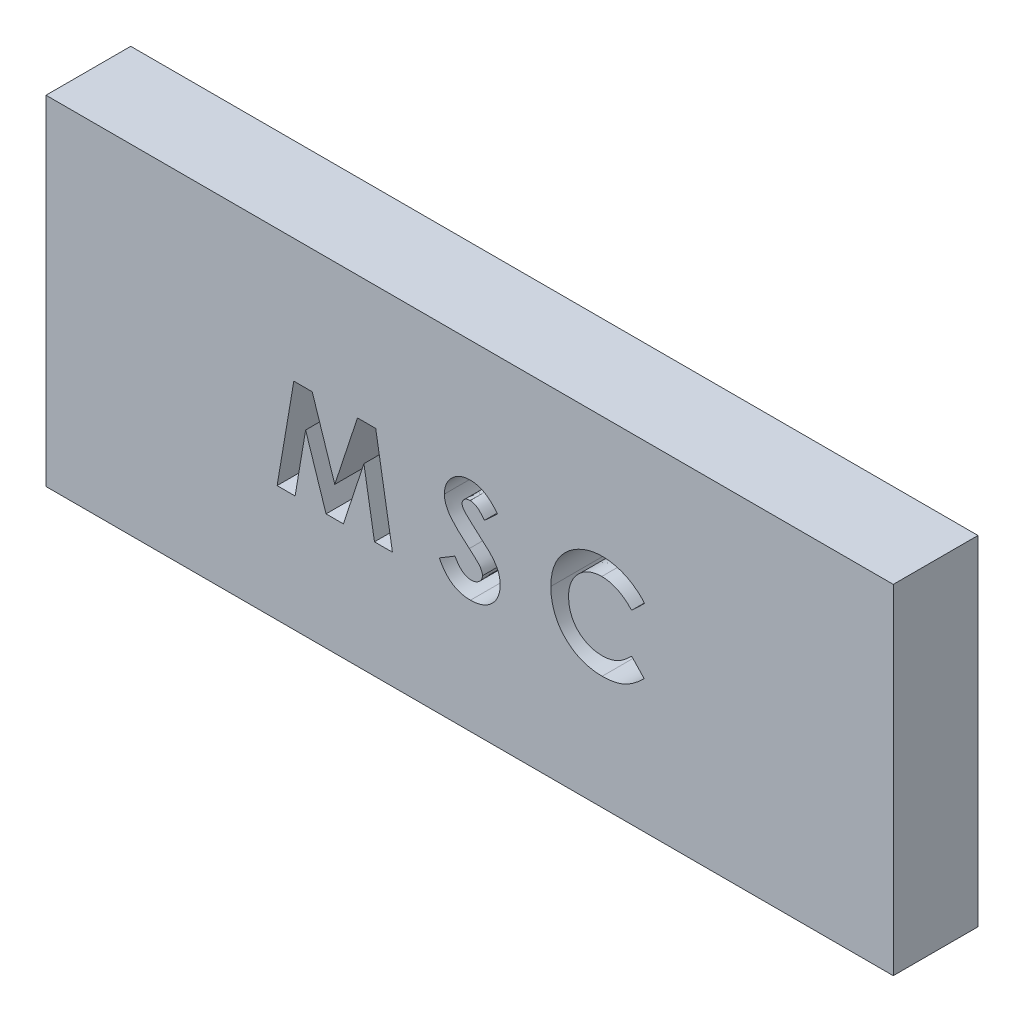
from build123d import *

# Parameters (mm, degrees)
ESQUISSE1_W        = 30
ESQUISSE1_H        = 12
BOSS_EXTRU_1_DEPTH = 3


with BuildPart() as part:
    # Esquisse1 → Boss.-Extru.1 (new body)
    with BuildSketch(Plane.XY):
        Rectangle(ESQUISSE1_W, ESQUISSE1_H)
        Polygon((-6.225764597, 1.619632403), (-5.573721328, 1.619632403), (-4.775143604, -0.821673687), (-3.970956905, 1.619632403), (-3.325223732, 1.619632403), (-2.733476937, -1.880367597), (-3.369394405, -1.880367597), (-3.743092322, 0.330269422), (-4.470856745, -1.880367597), (-5.083637193, -1.880367597), (-5.807194886, 0.330269422), (-6.180191681, -1.880367597), (-6.81681027, -1.880367597), align=None, mode=Mode.SUBTRACT)
        with BuildLine():
            Line((0.990882037, 1.151984166), (0.521130435, 0.722196505))
            add(Edge.make_bspline(
                [(0.521130435, 0.722196505), (0.50100829, 0.750580882), (0.462376579, 0.805074927), (0.399758605, 0.878043737), (0.337423383, 0.940291562), (0.274793415, 0.99155836), (0.211313573, 1.031532647), (0.14709405, 1.059834883), (0.082498922, 1.077826884), (0.039100968, 1.080067321), (0.017724986, 1.081170864)],
                knots=[0, 0, 0, 0, 1.299362458, 2.494594718, 3.587462134, 4.587049575, 5.512617175, 6.380583204, 7.202344345, 8, 8, 8, 8], degree=3))
            add(Edge.make_bspline(
                [(0.017724986, 1.081170864), (-0.002213917, 1.080471608), (-0.040710699, 1.079121529), (-0.095590718, 1.06570184), (-0.144313981, 1.042541428), (-0.186832935, 1.01225724), (-0.22051422, 0.975771815), (-0.247406114, 0.937507986), (-0.26254851, 0.895273371), (-0.264541547, 0.866264934), (-0.265528219, 0.851904037)],
                knots=[0, 0, 0, 0, 1.185010067, 2.2879431, 3.333075148, 4.379039566, 5.372662701, 6.27520591, 7.14612461, 8, 8, 8, 8], degree=3))
            add(Edge.make_bspline(
                [(-0.265528219, 0.851904037), (-0.264909922, 0.83733605), (-0.263664758, 0.807998147), (-0.251638164, 0.764999798), (-0.233510653, 0.722985405), (-0.216189076, 0.697409244), (-0.20733511, 0.684335928)],
                knots=[0, 0, 0, 0, 0.967525499, 1.948461899, 2.951351359, 4, 4, 4, 4], degree=3))
            add(Edge.make_bspline(
                [(-0.20733511, 0.684335928), (-0.199285898, 0.674174177), (-0.180757673, 0.650783166), (-0.145428144, 0.613735452), (-0.101061675, 0.56834876), (-0.045950952, 0.516183804), (0.017616229, 0.455364529), (0.092586288, 0.388281764), (0.176801259, 0.312858034), (0.23665931, 0.260335679), (0.268025467, 0.232813493)],
                knots=[0, 0, 0, 0, 0.473873513, 1.090794244, 1.870441696, 2.795289791, 3.865433203, 5.087734844, 6.473946851, 8, 8, 8, 8], degree=3))
            add(Edge.make_bspline(
                [(0.268025467, 0.232813493), (0.297467117, 0.207333229), (0.353341253, 0.158976983), (0.432839053, 0.090343055), (0.502704379, 0.028594784), (0.563955009, -0.025341121), (0.615662443, -0.072030571), (0.658044061, -0.111696742), (0.691617481, -0.143567406), (0.710702004, -0.162817306), (0.718846781, -0.171032661)],
                knots=[0, 0, 0, 0, 1.543621617, 2.929473131, 4.163658386, 5.240097082, 6.164993805, 6.925417477, 7.541396219, 8, 8, 8, 8], degree=3))
            add(Edge.make_bspline(
                [(0.718846781, -0.171032661), (0.749746365, -0.204472629), (0.809146218, -0.268755992), (0.886345087, -0.368374987), (0.949882253, -0.465623438), (0.99903581, -0.562331234), (1.036158553, -0.659893676), (1.062330578, -0.760703476), (1.078005179, -0.865814034), (1.079745425, -0.937539158), (1.080625627, -0.973817116)],
                knots=[0, 0, 0, 0, 1.206664779, 2.319633467, 3.337109185, 4.282041471, 5.190008762, 6.099243693, 7.03861361, 8, 8, 8, 8], degree=3))
            add(Edge.make_bspline(
                [(1.080625627, -0.973817116), (1.079999122, -1.009165538), (1.078769895, -1.078520456), (1.063714228, -1.180011049), (1.042245729, -1.27714195), (1.009051664, -1.36885624), (0.968594935, -1.456659379), (0.917876581, -1.539183674), (0.858314829, -1.617264305), (0.790047917, -1.689505485), (0.714536605, -1.755059349), (0.633543546, -1.813416947), (0.54627675, -1.861598577), (0.45348181, -1.901272713), (0.355208398, -1.931830263), (0.251573586, -1.954415141), (0.142418858, -1.967970228), (0.067777283, -1.969387252), (0.029644057, -1.970111187)],
                knots=[0, 0, 0, 0, 1.043214005, 2.046824704, 3.02475056, 3.976699089, 4.921714032, 5.875962561, 6.831408892, 7.817874052, 8.806269674, 9.781291748, 10.760897367, 11.74438705, 12.757449933, 13.795994037, 14.874007457, 16, 16, 16, 16], degree=3))
            add(Edge.make_bspline(
                [(0.029644057, -1.970111187), (-0.000290201, -1.969580133), (-0.059577199, -1.968528342), (-0.14695727, -1.959941346), (-0.231332607, -1.946082847), (-0.312608168, -1.926219478), (-0.391150114, -1.901049895), (-0.46696167, -1.870306214), (-0.539519484, -1.833511919), (-0.609372562, -1.791423647), (-0.676181334, -1.74255362), (-0.740790569, -1.687900968), (-0.802558507, -1.62662511), (-0.861781807, -1.558870961), (-0.918081542, -1.484446657), (-0.973300604, -1.404388695), (-1.024984891, -1.317211307), (-1.056912575, -1.256055664), (-1.073220527, -1.224818719)],
                knots=[0, 0, 0, 0, 1.016823716, 2.013894106, 2.979844003, 3.91962641, 4.853723003, 5.779685073, 6.695824784, 7.614987388, 8.547259901, 9.504950863, 10.487499108, 11.500346958, 12.559593716, 13.656357062, 14.802919212, 16, 16, 16, 16], degree=3))
            Line((-1.073220527, -1.224818719), (-0.520736552, -0.89318811))
            add(Edge.make_bspline(
                [(-0.520736552, -0.89318811), (-0.500337742, -0.928646124), (-0.461231478, -0.996622167), (-0.394962259, -1.087956596), (-0.327072827, -1.166169416), (-0.25599364, -1.22987821), (-0.182588993, -1.279934846), (-0.106504325, -1.315708792), (-0.027686182, -1.337852823), (0.026001157, -1.340557121), (0.052781076, -1.341906059)],
                knots=[0, 0, 0, 0, 1.283663364, 2.460892379, 3.537111102, 4.529833553, 5.449777664, 6.316464042, 7.160231139, 8, 8, 8, 8], degree=3))
            add(Edge.make_bspline(
                [(0.052781076, -1.341906059), (0.080020087, -1.340804443), (0.132867735, -1.338667148), (0.20830099, -1.318925601), (0.277461055, -1.287929924), (0.337242504, -1.243703367), (0.387861666, -1.192659198), (0.425221513, -1.135870226), (0.448691221, -1.074425929), (0.451172538, -1.031742679), (0.452420499, -1.01027545)],
                knots=[0, 0, 0, 0, 1.13588714, 2.203786484, 3.234766741, 4.283437687, 5.291419208, 6.222934724, 7.106237994, 8, 8, 8, 8], degree=3))
            add(Edge.make_bspline(
                [(0.452420499, -1.01027545), (0.451268059, -0.990303686), (0.448926986, -0.949732961), (0.431683371, -0.889410817), (0.404726339, -0.829116106), (0.372834271, -0.779660752), (0.340380097, -0.738253125), (0.309346588, -0.70237529), (0.271555982, -0.662736563), (0.227104101, -0.619287081), (0.17657827, -0.571644349), (0.119935927, -0.519813031), (0.056528458, -0.464249699), (0.011711934, -0.426400507), (-0.011722129, -0.406609584)],
                knots=[0, 0, 0, 0, 0.916159276, 1.861089862, 2.860218735, 3.940849679, 4.552606315, 5.27541173, 6.11797699, 7.06649574, 8.129236253, 9.306560635, 10.591630461, 12, 12, 12, 12], degree=3))
            add(Edge.make_bspline(
                [(-0.011722129, -0.406609584), (-0.056271216, -0.368916785), (-0.141774397, -0.296572895), (-0.262601239, -0.189723247), (-0.371477043, -0.08986246), (-0.467461439, 0.004243963), (-0.551777419, 0.090858094), (-0.623853956, 0.170683448), (-0.682899258, 0.244335766), (-0.745031707, 0.331572009), (-0.804069956, 0.437875365), (-0.855095756, 0.565770625), (-0.888199142, 0.693649658), (-0.891907916, 0.779500597), (-0.893733347, 0.8217558)],
                knots=[0, 0, 0, 0, 1.345494975, 2.582412109, 3.71882943, 4.751509156, 5.681369928, 6.505683931, 7.230279997, 7.856715994, 8.973648664, 10.023341002, 11.027102913, 12, 12, 12, 12], degree=3))
            add(Edge.make_bspline(
                [(-0.893733347, 0.8217558), (-0.892974153, 0.851720923), (-0.891478458, 0.910755433), (-0.878136631, 0.997557078), (-0.858196762, 1.081313372), (-0.829238347, 1.161718734), (-0.791653821, 1.238672453), (-0.746008875, 1.312551251), (-0.691594728, 1.382675162), (-0.630273658, 1.4489977), (-0.562713538, 1.509608952), (-0.490516965, 1.563104455), (-0.414092577, 1.608287535), (-0.3339079, 1.645770181), (-0.249466063, 1.674460765), (-0.161389144, 1.694798081), (-0.069550815, 1.706894068), (-0.007084365, 1.708538377), (0.024736204, 1.709375993)],
                knots=[0, 0, 0, 0, 1.010766082, 1.991317756, 2.957454644, 3.913069143, 4.869106762, 5.843196583, 6.838735724, 7.860187025, 8.887984031, 9.89767229, 10.887916223, 11.879572884, 12.879850636, 13.892031539, 14.926195476, 16, 16, 16, 16], degree=3))
            add(Edge.make_bspline(
                [(0.024736204, 1.709375993), (0.065974087, 1.707867423), (0.148124334, 1.704862192), (0.269585845, 1.681362267), (0.388224371, 1.644406159), (0.483825518, 1.599822681), (0.559893566, 1.556634645), (0.61819262, 1.516872542), (0.677515044, 1.471322915), (0.738339239, 1.419842227), (0.799534996, 1.361460512), (0.862842404, 1.297567595), (0.927398821, 1.22761129), (0.969350256, 1.17763483), (0.990882037, 1.151984166)],
                knots=[0, 0, 0, 0, 1.282922637, 2.555718331, 3.837320111, 5.142675274, 5.830281639, 6.55870424, 7.337177975, 8.157850921, 9.037902056, 9.96903443, 10.957596896, 12, 12, 12, 12], degree=3))
        make_face(mode=Mode.SUBTRACT)
        with BuildLine():
            Line((6.196010242, 1.012460928), (5.735373223, 0.572156441))
            add(Edge.make_bspline(
                [(5.735373223, 0.572156441), (5.696298238, 0.612560041), (5.619972552, 0.691480929), (5.496983147, 0.79596523), (5.369078644, 0.883038758), (5.238747169, 0.956371528), (5.103644438, 1.011852995), (4.965332606, 1.052283275), (4.822928511, 1.076932089), (4.726554896, 1.079752349), (4.678081557, 1.081170864)],
                knots=[0, 0, 0, 0, 1.115251505, 2.178435587, 3.19620269, 4.182487026, 5.141301733, 6.088180966, 7.038406374, 8, 8, 8, 8], degree=3))
            add(Edge.make_bspline(
                [(4.678081557, 1.081170864), (4.637600427, 1.080050188), (4.557715379, 1.077838656), (4.440423194, 1.061625946), (4.328227157, 1.034055526), (4.220743204, 0.996058382), (4.11828761, 0.946892093), (4.020645565, 0.886594714), (3.928057802, 0.815710816), (3.84174735, 0.734607155), (3.762793581, 0.64599531), (3.6930329, 0.551446684), (3.634597139, 0.45117788), (3.586639861, 0.346204349), (3.549282994, 0.236040221), (3.522605499, 0.120759662), (3.507175948, 0.000225383), (3.504872984, -0.081712922), (3.50370255, -0.123356379)],
                knots=[0, 0, 0, 0, 1.035432265, 2.043311493, 3.022114605, 3.98653278, 4.95457646, 5.923598177, 6.917315552, 7.932509744, 8.948865224, 9.949768934, 10.933144597, 11.912367597, 12.897413939, 13.903909035, 14.934704909, 16, 16, 16, 16], degree=3))
            add(Edge.make_bspline(
                [(3.50370255, -0.123356379), (3.504039856, -0.152584671), (3.504704692, -0.210194235), (3.511982504, -0.295414769), (3.523701496, -0.378098834), (3.540661781, -0.458121185), (3.561870785, -0.535551172), (3.586753775, -0.611056778), (3.617969121, -0.683594685), (3.652618625, -0.754007376), (3.6929156, -0.82037355), (3.736363172, -0.883659206), (3.78347497, -0.943554122), (3.834556141, -0.999813447), (3.890325588, -1.051557973), (3.949341877, -1.10034372), (4.012600531, -1.144949415), (4.078787509, -1.186494488), (4.148474581, -1.222585046), (4.219770975, -1.255276119), (4.29375769, -1.28182613), (4.369533892, -1.303227862), (4.446828784, -1.321426838), (4.526398381, -1.332632507), (4.607552915, -1.341118429), (4.662399758, -1.341642386), (4.690000627, -1.341906059)],
                knots=[0, 0, 0, 0, 1.103660481, 2.175337485, 3.227646561, 4.255952547, 5.262355991, 6.258840057, 7.255597736, 8.242457506, 9.22035537, 10.185017736, 11.140346927, 12.096287581, 13.051739095, 14.01125915, 14.986044842, 15.97314143, 16.960198552, 17.947847494, 18.933482797, 19.925264591, 20.920966487, 21.929612487, 22.958107872, 24, 24, 24, 24], degree=3))
            add(Edge.make_bspline(
                [(4.690000627, -1.341906059), (4.736816444, -1.340551897), (4.82879735, -1.337891321), (4.963792556, -1.317085994), (5.092429538, -1.282862408), (5.195209871, -1.242446342), (5.275735548, -1.202534953), (5.337038555, -1.165618882), (5.400430642, -1.124324205), (5.464858921, -1.077092414), (5.531048082, -1.02449031), (5.597829734, -0.965365809), (5.666913499, -0.901665796), (5.712169588, -0.856201845), (5.735373223, -0.832891636)],
                knots=[0, 0, 0, 0, 1.404581149, 2.759636711, 4.088442092, 5.392261763, 6.066678138, 6.783632037, 7.538459478, 8.336747902, 9.180226004, 10.074962426, 11.012997595, 12, 12, 12, 12], degree=3))
            Line((5.735373223, -0.832891636), (6.181987807, -1.301942116))
            add(Edge.make_bspline(
                [(6.181987807, -1.301942116), (6.150593205, -1.332252618), (6.089317658, -1.391412236), (5.996885195, -1.475413373), (5.904569062, -1.550897732), (5.814599425, -1.620605065), (5.725502486, -1.682504629), (5.637287695, -1.736658242), (5.550953681, -1.784435529), (5.464707692, -1.825030748), (5.378013059, -1.859500306), (5.28881447, -1.889176332), (5.196839236, -1.914281183), (5.101525614, -1.934537501), (5.003762633, -1.950780333), (4.902635359, -1.961744151), (4.798784991, -1.969114761), (4.728341677, -1.969777071), (4.692805114, -1.970111187)],
                knots=[0, 0, 0, 0, 1.244526981, 2.429050516, 3.560637417, 4.644440555, 5.67424972, 6.652764056, 7.595344123, 8.486817594, 9.369275933, 10.254498637, 11.166417451, 12.086725134, 13.032340136, 13.991389299, 14.986715468, 16, 16, 16, 16], degree=3))
            add(Edge.make_bspline(
                [(4.692805114, -1.970111187), (4.62752885, -1.968447165), (4.499801346, -1.965191136), (4.31262002, -1.941066167), (4.134802784, -1.900621082), (3.965917043, -1.843420576), (3.806016499, -1.770349609), (3.655142059, -1.680768036), (3.513536898, -1.57491386), (3.382344909, -1.454027794), (3.263675512, -1.320519283), (3.158785506, -1.177167769), (3.07202049, -1.023268731), (2.999977628, -0.861095751), (2.943641057, -0.68990877), (2.903989662, -0.509522615), (2.879536935, -0.320111461), (2.876861772, -0.190739276), (2.875497422, -0.124758623)],
                knots=[0, 0, 0, 0, 1.078019885, 2.10938526, 3.111377082, 4.085535484, 5.04941344, 6.010039228, 6.978205633, 7.964457913, 8.951525778, 9.924444315, 10.892603023, 11.863865945, 12.85144698, 13.863884204, 14.910567087, 16, 16, 16, 16], degree=3))
            add(Edge.make_bspline(
                [(2.875497422, -0.124758623), (2.87607393, -0.081726604), (2.877216429, 0.003552341), (2.889224196, 0.129175136), (2.905963722, 0.25163489), (2.932519458, 0.369660066), (2.964529778, 0.48484068), (3.004338817, 0.595924854), (3.051882994, 0.703231854), (3.105629849, 0.80694132), (3.166433128, 0.906373843), (3.234357065, 1.00067514), (3.307653034, 1.090573201), (3.388082217, 1.174875362), (3.474475873, 1.25432181), (3.567224059, 1.328482011), (3.665768942, 1.398419506), (3.770377245, 1.462330776), (3.879016708, 1.520141917), (3.990317102, 1.571133812), (4.104004974, 1.613751294), (4.219599642, 1.649100923), (4.337589492, 1.675486922), (4.457132342, 1.695460272), (4.579245358, 1.706625502), (4.66123367, 1.708453322), (4.702620819, 1.709375993)],
                knots=[0, 0, 0, 0, 1.071919942, 2.124283339, 3.142214191, 4.149696895, 5.136002878, 6.119640489, 7.086990633, 8.058538607, 9.028339693, 9.988281803, 10.952401235, 11.916291999, 12.888973767, 13.874849856, 14.873389453, 15.898127285, 16.927174885, 17.938320013, 18.946391617, 19.950418109, 20.947802303, 21.956882652, 22.968648068, 24, 24, 24, 24], degree=3))
            add(Edge.make_bspline(
                [(4.702620819, 1.709375993), (4.737928302, 1.708847095), (4.808176167, 1.707794798), (4.912787025, 1.699022757), (5.016561256, 1.685246356), (5.119127314, 1.664460701), (5.221218857, 1.639785502), (5.321494288, 1.607476732), (5.421535505, 1.57146252), (5.519773512, 1.528414882), (5.616345434, 1.481424497), (5.708988921, 1.4281122), (5.799259449, 1.371758768), (5.885156677, 1.309028959), (5.968289646, 1.2421981), (6.048223645, 1.170954387), (6.124257208, 1.094109979), (6.171971651, 1.039814869), (6.196010242, 1.012460928)],
                knots=[0, 0, 0, 0, 0.996412454, 1.982464992, 2.961075852, 3.949442424, 4.934965278, 5.923860011, 6.921385422, 7.934793307, 8.949617135, 9.951082467, 10.950285876, 11.951772932, 12.951063433, 13.960125323, 14.972308753, 16, 16, 16, 16], degree=3))
        make_face(mode=Mode.SUBTRACT)
    extrude(amount=BOSS_EXTRU_1_DEPTH)


solid = part.part
